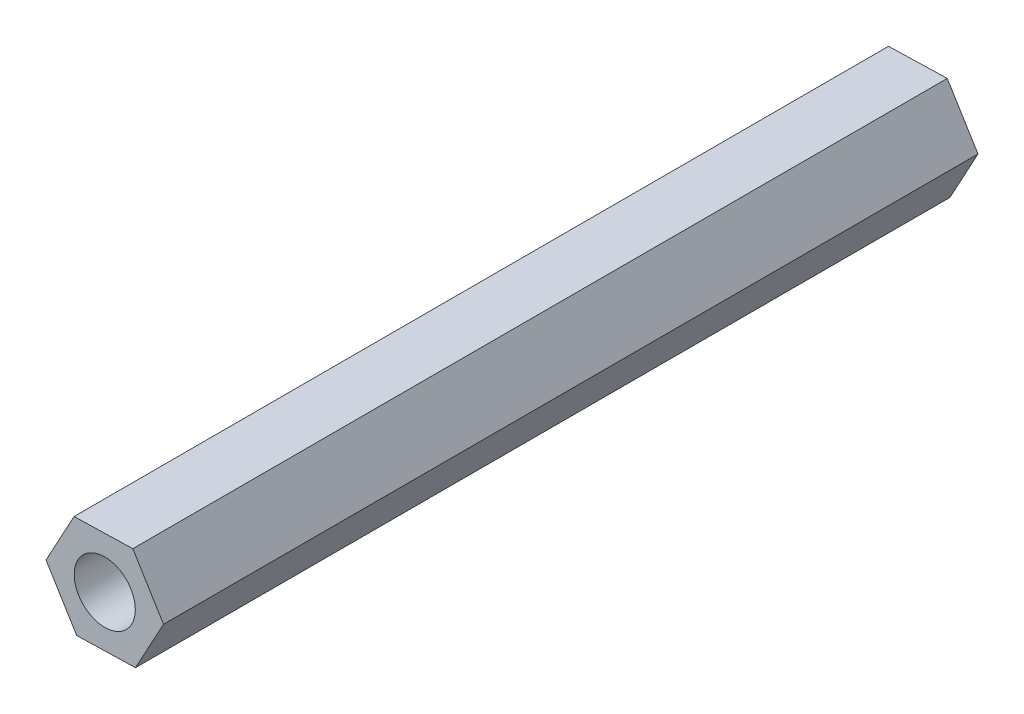
from build123d import *

# Parameters (mm, degrees)
ESQUISSE1_R        = 1.5
BOSS_EXTRU_1_DEPTH = 40


with BuildPart() as part:
    # Esquisse1 → Boss.-Extru.1 (new body)
    with BuildSketch(Plane.XY):
        Polygon((1.377468666, 2.536910209), (-1.508294355, 2.461377962), (-2.885763021, -0.075532246), (-1.377468666, -2.536910209), (1.508294355, -2.461377962), (2.885763021, 0.075532246), align=None)
        Circle(ESQUISSE1_R, mode=Mode.SUBTRACT)
    extrude(amount=BOSS_EXTRU_1_DEPTH)


solid = part.part
